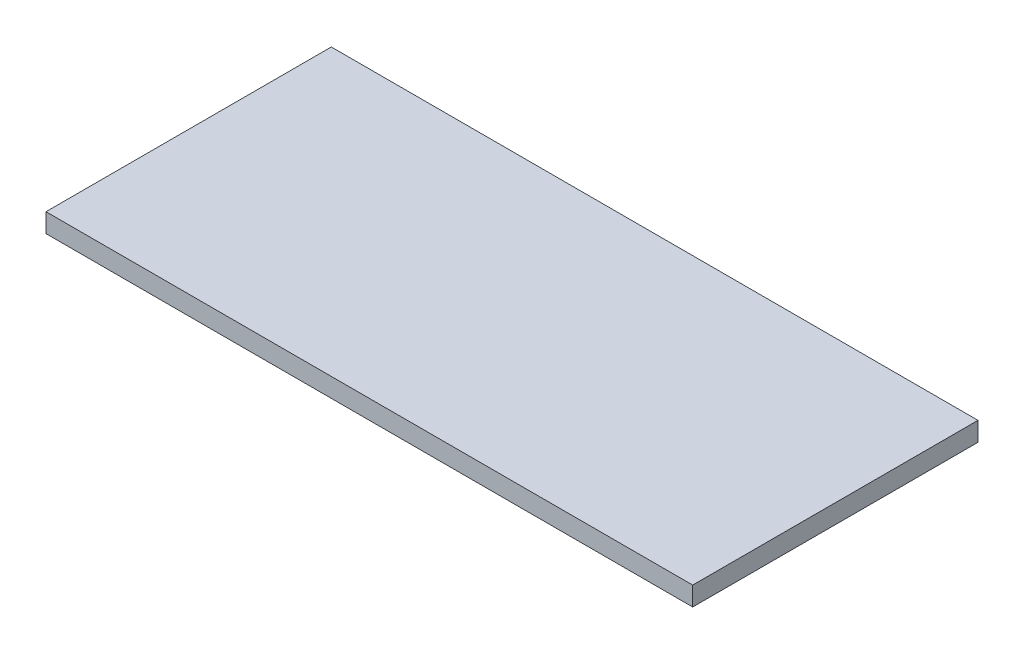
from build123d import *

# Parameters (mm, degrees)
SKETCH_1_W      = 68
SKETCH_1_H      = 30
EXTRUDE_1_DEPTH = 2


with BuildPart() as part:
    # 草图1 → 凸台-拉伸1 (new body)
    with BuildSketch(Plane(origin=(0, 0, 0), x_dir=(1, 0, 0), z_dir=(0, 1, 0))):
        with Locations((34, 15)):
            Rectangle(SKETCH_1_W, SKETCH_1_H)
    extrude(amount=EXTRUDE_1_DEPTH)


solid = part.part
